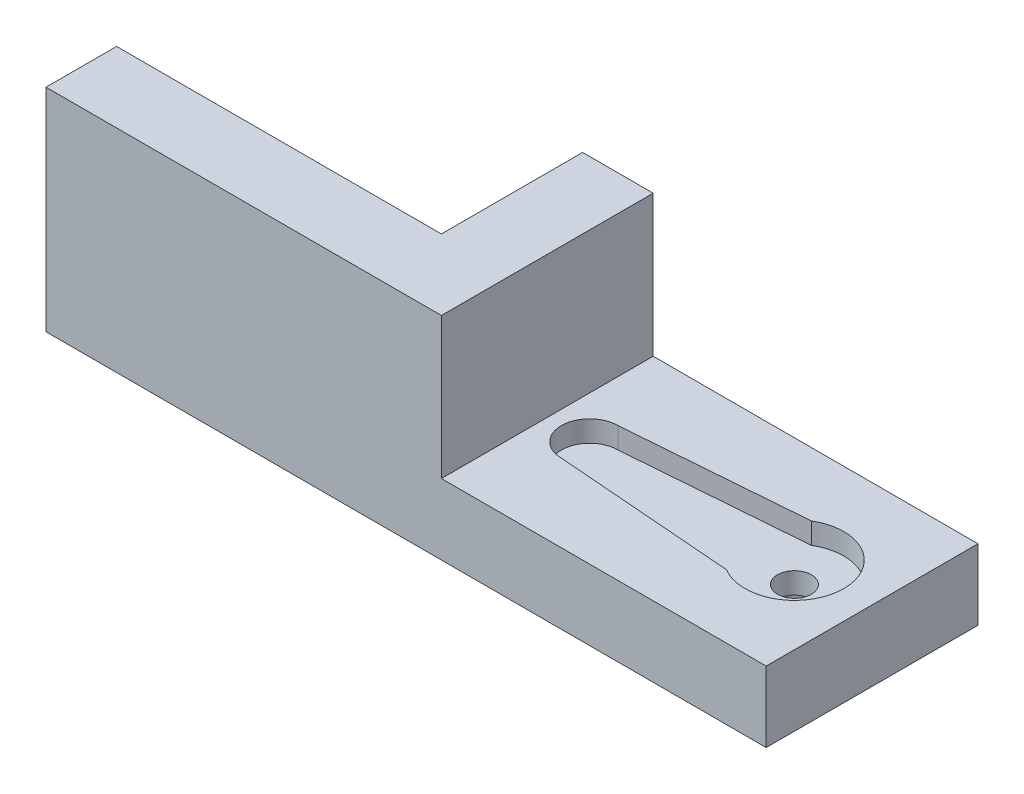
from build123d import *

# Parameters (mm, degrees)
SKETCH_1_W                   = 28
SKETCH_1_H                   = 15
EXTRUDE_1_DEPTH              = 5
SKETCH_2_W                   = 5
SKETCH_2_H                   = 15
EXTRUDE_2_DEPTH              = 10
SKETCH_3_W                   = 5
SKETCH_3_H                   = 15
EXTRUDE_3_DEPTH              = 23
CUT_EXTRUDE_1_DEPTH          = 1.5
HOLE_WIZARD_M2_1_D           = 2.4
HOLE_WIZARD_M2_1_CBORE_D     = 4.4
HOLE_WIZARD_M2_1_CBORE_DEPTH = 2
CUT_EXTRUDE_2_DEPTH          = 1.5


with BuildPart() as part:
    # 草图1 → 凸台-拉伸1 (new body)
    with BuildSketch(Plane(origin=(0, 0, 0), x_dir=(1, 0, 0), z_dir=(0, 1, 0))):
        Rectangle(SKETCH_1_W, SKETCH_1_H)
    extrude(amount=EXTRUDE_1_DEPTH)

    # 草图2 → 凸台-拉伸2 (add)
    with BuildSketch(Plane(origin=(0, 5, 0), x_dir=(1, 0, 0), z_dir=(0, 1, 0))):
        with Locations((-11.5, 0)):
            Rectangle(SKETCH_2_W, SKETCH_2_H)
    extrude(amount=EXTRUDE_2_DEPTH)

    # 草图3 → 凸台-拉伸3 (add)
    with BuildSketch(Plane.ZY.offset(14)):
        with Locations((5, 7.5)):
            Rectangle(SKETCH_3_W, SKETCH_3_H)
    extrude(amount=EXTRUDE_3_DEPTH)

    # 草图4 → 切除-拉伸1 (cut)
    with BuildSketch(Plane(origin=(0, 5, 0), x_dir=(1, 0, 0), z_dir=(0, 1, 0))):
        with BuildLine():
            Line((-6, 2), (6.697224362, 3))
            ThreePointArc((6.697224362, 3), (12, 0), (6.697224362, -3))
            Line((6.697224362, -3), (-6, -2))
            ThreePointArc((-6, -2), (-8, 0), (-6, 2))
        make_face()
    extrude(amount=-CUT_EXTRUDE_1_DEPTH, mode=Mode.SUBTRACT)

    # M2 凹头盖螺钉的柱形沉头孔1 (through all)
    with Locations(Plane(origin=(8.5, 0, 0), x_dir=(0, 0, -1), z_dir=(0, -1, 0))):
        with Locations((0, 0)):
            CounterBoreHole(HOLE_WIZARD_M2_1_D / 2, HOLE_WIZARD_M2_1_CBORE_D / 2, HOLE_WIZARD_M2_1_CBORE_DEPTH)

    # 草图7 → 切除-拉伸2 (cut)
    with BuildSketch(Plane(origin=(0, 0, 2.5), x_dir=(-1, 0, 0), z_dir=(0, 0, -1))):
        with BuildLine():
            Line((17, 9.5), (29.697224362, 10.5))
            ThreePointArc((29.697224362, 10.5), (35, 7.5), (29.697224362, 4.5))
            Line((29.697224362, 4.5), (17, 5.5))
            ThreePointArc((17, 5.5), (15, 7.5), (17, 9.5))
        make_face()
    extrude(amount=-CUT_EXTRUDE_2_DEPTH, mode=Mode.SUBTRACT)


solid = part.part
